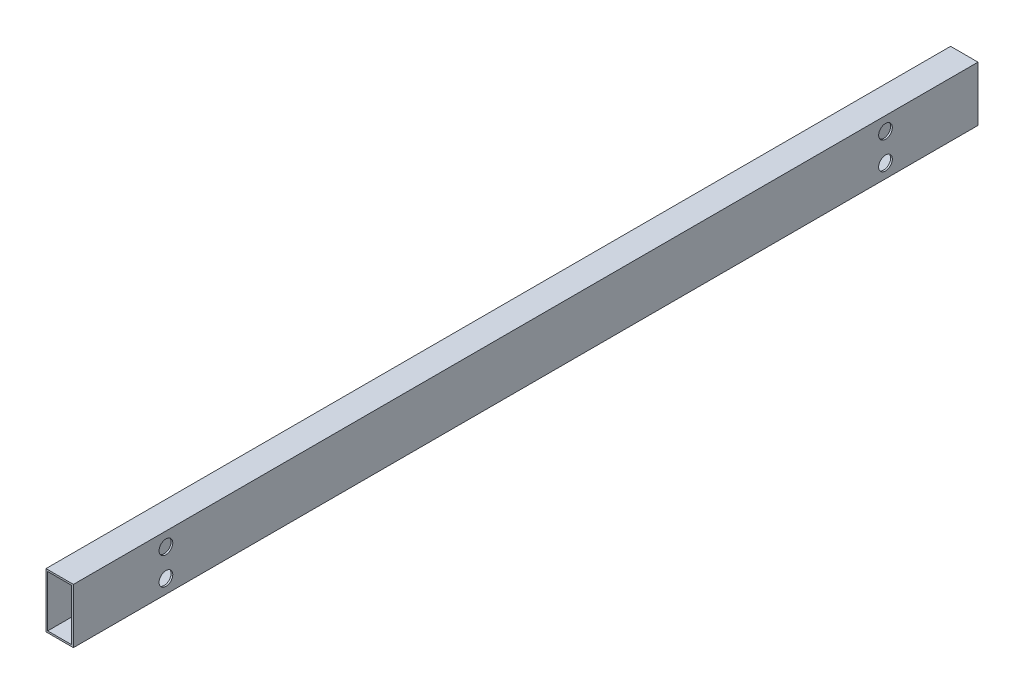
from build123d import *

# Parameters (mm, degrees)
SKETCH1_W           = 25.4
SKETCH1_H           = 50.8
SKETCH1_W_2         = 22.225
SKETCH1_H_2         = 47.625
BOSS_EXTRUDE1_DEPTH = 838.2
SKETCH2_R           = 3.175
CUT_EXTRUDE1_DEPTH  = 839.969343898
CUT_EXTRUDE2_REACH  = 840.969
SKETCH3_R           = 6.35


with BuildPart() as part:
    # Sketch1 → Boss-Extrude1 (new body)
    with BuildSketch(Plane.XY):
        Rectangle(SKETCH1_W, SKETCH1_H)
        Rectangle(SKETCH1_W_2, SKETCH1_H_2, mode=Mode.SUBTRACT)
    extrude(amount=BOSS_EXTRUDE1_DEPTH)

    # Sketch2 → Cut-Extrude1 (cut, through all)
    with BuildSketch(Plane(origin=(12.7, 0, 0), x_dir=(0, 0, -1), z_dir=(1, 0, 0))):
        with Locations((-85.725, 12.7)):
            Circle(SKETCH2_R)
        with Locations((-85.725, -12.7)):
            Circle(SKETCH2_R)
        with Locations((-752.475, 12.7)):
            Circle(SKETCH2_R)
        with Locations((-752.475, -12.7)):
            Circle(SKETCH2_R)
    extrude(amount=-CUT_EXTRUDE1_DEPTH, mode=Mode.SUBTRACT)

    # Sketch3 → Cut-Extrude2 (cut, up to next)
    with BuildSketch(Plane(origin=(12.7, 0, 0), x_dir=(0, 0, -1), z_dir=(1, 0, 0)), mode=Mode.PRIVATE) as cut_extrude2_sk1:
        with Locations((-752.475, 12.7)):
            Circle(SKETCH3_R)
    cut_extrude2_tool1 = extrude(cut_extrude2_sk1.sketch, amount=-CUT_EXTRUDE2_REACH, mode=Mode.PRIVATE) & part.part
    # Sketch3 → Cut-Extrude2 (cut, up to next)
    with BuildSketch(Plane(origin=(12.7, 0, 0), x_dir=(0, 0, -1), z_dir=(1, 0, 0)), mode=Mode.PRIVATE) as cut_extrude2_sk2:
        with Locations((-752.475, -12.7)):
            Circle(SKETCH3_R)
    cut_extrude2_tool2 = extrude(cut_extrude2_sk2.sketch, amount=-CUT_EXTRUDE2_REACH, mode=Mode.PRIVATE) & part.part
    # Sketch3 → Cut-Extrude2 (cut, up to next)
    with BuildSketch(Plane(origin=(12.7, 0, 0), x_dir=(0, 0, -1), z_dir=(1, 0, 0)), mode=Mode.PRIVATE) as cut_extrude2_sk3:
        with Locations((-85.725, 12.7)):
            Circle(SKETCH3_R)
    cut_extrude2_tool3 = extrude(cut_extrude2_sk3.sketch, amount=-CUT_EXTRUDE2_REACH, mode=Mode.PRIVATE) & part.part
    # Sketch3 → Cut-Extrude2 (cut, up to next)
    with BuildSketch(Plane(origin=(12.7, 0, 0), x_dir=(0, 0, -1), z_dir=(1, 0, 0)), mode=Mode.PRIVATE) as cut_extrude2_sk4:
        with Locations((-85.725, -12.7)):
            Circle(SKETCH3_R)
    cut_extrude2_tool4 = extrude(cut_extrude2_sk4.sketch, amount=-CUT_EXTRUDE2_REACH, mode=Mode.PRIVATE) & part.part
    add(cut_extrude2_tool1.solids().sort_by_distance((12.7, 12.7, 752.475))[0], mode=Mode.SUBTRACT)
    add(cut_extrude2_tool2.solids().sort_by_distance((12.7, -12.7, 752.475))[0], mode=Mode.SUBTRACT)
    add(cut_extrude2_tool3.solids().sort_by_distance((12.7, 12.7, 85.725))[0], mode=Mode.SUBTRACT)
    add(cut_extrude2_tool4.solids().sort_by_distance((12.7, -12.7, 85.725))[0], mode=Mode.SUBTRACT)


solid = part.part
